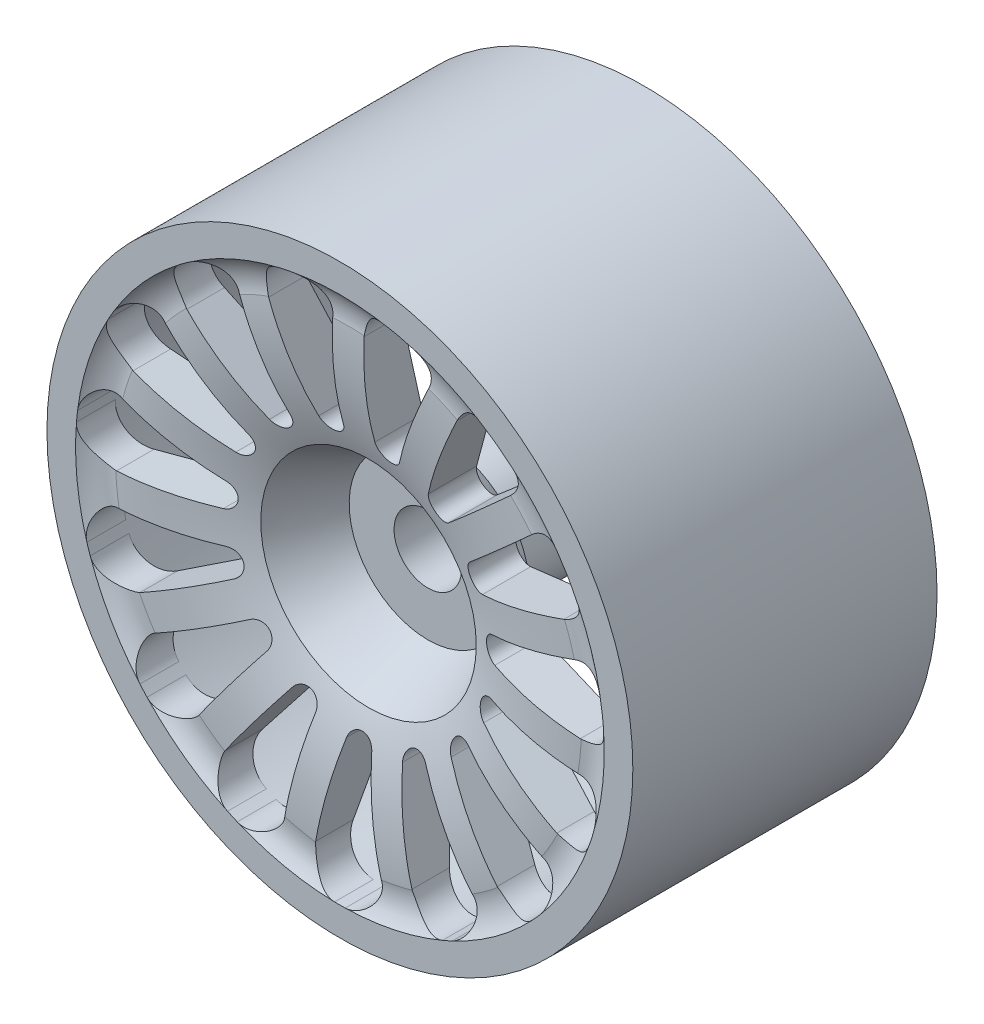
from build123d import *

# Parameters (mm, degrees)
CROQUIS1_R              = 26
CROQUIS1_R_2            = 23.46
SALIENTE_EXTRUIR1_DEPTH = 27
CROQUIS2_R              = 9.5631
SALIENTE_EXTRUIR2_DEPTH = 9.1948


with BuildPart() as part:
    # Croquis1 → Saliente-Extruir1 (new body)
    with BuildSketch(Plane.XY):
        Circle(CROQUIS1_R)
        Circle(CROQUIS1_R_2, mode=Mode.SUBTRACT)
    extrude(amount=-SALIENTE_EXTRUIR1_DEPTH)

    # Croquis2 → Saliente-Extruir2 (add)
    with BuildSketch(Plane.XY):
        with BuildLine():
            Line((1.397, 20.54620235), (1.397, 11.966276937))
            ThreePointArc((1.397, 11.966276937), (2.305137707, 10.844820264), (3.590900307, 11.499949031))
            Line((3.590900307, 11.499949031), (7.080670367, 19.338100919))
            ThreePointArc((7.080670367, 19.338100919), (7.034905865, 21.501525446), (5.338232059, 22.844580944))
            ThreePointArc((5.338232059, 22.844580944), (9.542041647, 21.431776436), (13.404857664, 19.25308783))
            ThreePointArc((13.404857664, 19.25308783), (11.271476548, 19.61528265), (9.633116376, 18.201678738))
            Line((9.633116376, 18.201678738), (6.143346316, 10.36352685))
            ThreePointArc((6.143346316, 10.36352685), (6.516833871, 8.969652318), (7.957901329, 9.045175464))
            Line((7.957901329, 9.045175464), (14.334028502, 14.786266158))
            ThreePointArc((14.334028502, 14.786266158), (15.172164579, 16.781266908), (14.168445815, 18.698308565))
            ThreePointArc((14.168445815, 18.698308565), (17.434177606, 15.697804025), (20.076883142, 12.136324126))
            ThreePointArc((20.076883142, 12.136324126), (18.27526042, 13.334929832), (16.203579417, 12.709919516))
            Line((16.203579417, 12.709919516), (9.827452243, 6.968828821))
            ThreePointArc((9.827452243, 6.968828821), (9.601710254, 5.54355), (10.948908915, 5.026408886))
            Line((10.948908915, 5.026408886), (19.108902889, 7.677751649))
            ThreePointArc((19.108902889, 7.677751649), (20.686018202, 9.159374868), (20.548806573, 11.318928767))
            ThreePointArc((20.548806573, 11.318928767), (22.311785872, 7.249538688), (23.277433133, 2.921079725))
            ThreePointArc((23.277433133, 2.921079725), (22.119085739, 4.748846502), (19.972296371, 5.020499743))
            Line((19.972296371, 5.020499743), (11.812302397, 2.36915698))
            ThreePointArc((11.812302397, 2.36915698), (11.026363706, 1.158917525), (12.046750683, 0.138530549))
            Line((12.046750683, 0.138530549), (20.579674367, -0.75831587))
            ThreePointArc((20.579674367, -0.75831587), (22.623071352, -0.046256297), (23.376091994, 1.982403356))
            ThreePointArc((23.376091994, 1.982403356), (23.331483665, -2.452237748), (22.453103465, -6.799245898))
            ThreePointArc((22.453103465, -6.799245898), (22.138320189, -4.658355531), (20.28762184, -3.537010045))
            Line((20.28762184, -3.537010045), (11.754698156, -2.640163627))
            ThreePointArc((11.754698156, -2.640163627), (10.544458702, -3.426102318), (11.061599816, -4.773300979))
            Line((11.061599816, -4.773300979), (18.492033186, -9.063263686))
            ThreePointArc((18.492033186, -9.063263686), (20.64838994, -9.243889327), (22.161438745, -7.696897605))
            ThreePointArc((22.161438745, -7.696897605), (20.316955973, -11.73), (17.746428229, -15.343920135))
            ThreePointArc((17.746428229, -15.343920135), (18.329637957, -13.260085572), (17.095033186, -11.482938664))
            Line((17.095033186, -11.482938664), (9.664599816, -7.192975957))
            ThreePointArc((9.664599816, -7.192975957), (8.239320995, -7.418717946), (8.163797849, -8.859785404))
            Line((8.163797849, -8.859785404), (13.206951473, -15.801090873))
            ThreePointArc((13.206951473, -15.801090873), (15.103414324, -16.843169915), (17.114871406, -16.045335046))
            ThreePointArc((17.114871406, -16.045335046), (13.789442019, -18.979538688), (9.971234331, -21.235491186))
            ThreePointArc((9.971234331, -21.235491186), (11.351594804, -19.569026354), (10.946557991, -17.443362868))
            Line((10.946557991, -17.443362868), (5.903404367, -10.502057399))
            ThreePointArc((5.903404367, -10.502057399), (4.509529835, -10.128569843), (3.854401069, -11.414332443))
            Line((3.854401069, -11.414332443), (5.638267869, -19.806765901))
            ThreePointArc((5.638267869, -19.806765901), (6.94692116, -21.530113409), (9.108987318, -21.61938829))
            ThreePointArc((9.108987318, -21.61938829), (4.877608267, -22.947342713), (0.471923431, -23.455252893))
            ThreePointArc((0.471923431, -23.455252893), (2.410757783, -22.4943047), (2.905323472, -20.387671165))
            Line((2.905323472, -20.387671165), (1.121456672, -11.995237707))
            ThreePointArc((1.121456672, -11.995237707), (0, -11.0871), (-1.121456672, -11.995237707))
            Line((-1.121456672, -11.995237707), (-2.905323472, -20.387671165))
            ThreePointArc((-2.905323472, -20.387671165), (-2.410757783, -22.4943047), (-0.471923431, -23.455252893))
            ThreePointArc((-0.471923431, -23.455252893), (-4.877608267, -22.947342713), (-9.108987318, -21.61938829))
            ThreePointArc((-9.108987318, -21.61938829), (-6.94692116, -21.530113409), (-5.638267869, -19.806765901))
            Line((-5.638267869, -19.806765901), (-3.854401069, -11.414332443))
            ThreePointArc((-3.854401069, -11.414332443), (-4.509529835, -10.128569843), (-5.903404367, -10.502057399))
            Line((-5.903404367, -10.502057399), (-10.946557991, -17.443362868))
            ThreePointArc((-10.946557991, -17.443362868), (-11.351594804, -19.569026354), (-9.971234331, -21.235491186))
            ThreePointArc((-9.971234331, -21.235491186), (-13.789442019, -18.979538688), (-17.114871406, -16.045335046))
            ThreePointArc((-17.114871406, -16.045335046), (-15.103414324, -16.843169915), (-13.206951473, -15.801090873))
            Line((-13.206951473, -15.801090873), (-8.163797849, -8.859785404))
            ThreePointArc((-8.163797849, -8.859785404), (-8.239320995, -7.418717946), (-9.664599816, -7.192975957))
            Line((-9.664599816, -7.192975957), (-17.095033186, -11.482938664))
            ThreePointArc((-17.095033186, -11.482938664), (-18.329637957, -13.260085572), (-17.746428229, -15.343920135))
            ThreePointArc((-17.746428229, -15.343920135), (-20.316955973, -11.73), (-22.161438745, -7.696897605))
            ThreePointArc((-22.161438745, -7.696897605), (-20.64838994, -9.243889327), (-18.492033186, -9.063263686))
            Line((-18.492033186, -9.063263686), (-11.061599816, -4.773300979))
            ThreePointArc((-11.061599816, -4.773300979), (-10.544458702, -3.426102318), (-11.754698156, -2.640163627))
            Line((-11.754698156, -2.640163627), (-20.28762184, -3.537010045))
            ThreePointArc((-20.28762184, -3.537010045), (-22.138320189, -4.658355531), (-22.453103465, -6.799245898))
            ThreePointArc((-22.453103465, -6.799245898), (-23.331483665, -2.452237748), (-23.376091994, 1.982403356))
            ThreePointArc((-23.376091994, 1.982403356), (-22.623071352, -0.046256297), (-20.579674367, -0.75831587))
            Line((-20.579674367, -0.75831587), (-12.046750683, 0.138530549))
            ThreePointArc((-12.046750683, 0.138530549), (-11.026363706, 1.158917525), (-11.812302397, 2.36915698))
            Line((-11.812302397, 2.36915698), (-19.972296371, 5.020499743))
            ThreePointArc((-19.972296371, 5.020499743), (-22.119085739, 4.748846502), (-23.277433133, 2.921079725))
            ThreePointArc((-23.277433133, 2.921079725), (-22.311785872, 7.249538688), (-20.548806573, 11.318928767))
            ThreePointArc((-20.548806573, 11.318928767), (-20.686018202, 9.159374868), (-19.108902889, 7.677751649))
            Line((-19.108902889, 7.677751649), (-10.948908915, 5.026408886))
            ThreePointArc((-10.948908915, 5.026408886), (-9.601710254, 5.54355), (-9.827452243, 6.968828821))
            Line((-9.827452243, 6.968828821), (-16.203579417, 12.709919516))
            ThreePointArc((-16.203579417, 12.709919516), (-18.27526042, 13.334929832), (-20.076883142, 12.136324126))
            ThreePointArc((-20.076883142, 12.136324126), (-17.434177606, 15.697804025), (-14.168445815, 18.698308565))
            ThreePointArc((-14.168445815, 18.698308565), (-15.172164579, 16.781266908), (-14.334028502, 14.786266158))
            Line((-14.334028502, 14.786266158), (-7.957901329, 9.045175464))
            ThreePointArc((-7.957901329, 9.045175464), (-6.516833871, 8.969652318), (-6.143346316, 10.36352685))
            Line((-6.143346316, 10.36352685), (-9.633116376, 18.201678738))
            ThreePointArc((-9.633116376, 18.201678738), (-11.271476548, 19.61528265), (-13.404857664, 19.25308783))
            ThreePointArc((-13.404857664, 19.25308783), (-9.542041647, 21.431776436), (-5.338232059, 22.844580944))
            ThreePointArc((-5.338232059, 22.844580944), (-7.034905865, 21.501525446), (-7.080670367, 19.338100919))
            Line((-7.080670367, 19.338100919), (-3.590900307, 11.499949031))
            ThreePointArc((-3.590900307, 11.499949031), (-2.305137707, 10.844820264), (-1.397, 11.966276937))
            Line((-1.397, 11.966276937), (-1.397, 20.54620235))
            ThreePointArc((-1.397, 20.54620235), (-2.318751983, 22.503974899), (-4.415010516, 23.04081774))
            ThreePointArc((-4.415010516, 23.04081774), (0, 23.46), (4.415010516, 23.04081774))
            ThreePointArc((4.415010516, 23.04081774), (2.318751983, 22.503974899), (1.397, 20.54620235))
        make_face()
        Circle(CROQUIS2_R, mode=Mode.SUBTRACT)
    extrude(amount=-SALIENTE_EXTRUIR2_DEPTH)

    # Croquis3 → Cortar-Revolución1 (revolve, cut)
    with BuildSketch(Plane(origin=(0, 0, 0), x_dir=(1, 0, 0), z_dir=(0, 1, 0)), mode=Mode.PRIVATE) as cortar_revoluci_n1_sk:
        Polygon((-9.5631, 6.5405), (-9.5631, 30.1625), (-23.46, 30.1625), (-23.46, 3.4544), align=None)
        with BuildLine():
            Line((-9.5631, 0), (-9.5631, 2.54))
            ThreePointArc((-9.5631, 2.54), (-15.018806531, 1.053120268), (-20.666, 0.762))
            ThreePointArc((-20.666, 0.762), (-22.152542948, 0.709324142), (-23.46, 0))
            Line((-23.46, 0), (-9.5631, 0))
        make_face()
    revolve(cortar_revoluci_n1_sk.sketch.rotate(Axis((0, 0, 0), (0, 0, -1)), 180), axis=Axis((0, 0, 0), (0, 0, -1)), mode=Mode.SUBTRACT)

    # Croquis4 → Revolución1 (revolve)
    with BuildSketch(Plane(origin=(0, 0, 0), x_dir=(0, 0, -1), z_dir=(1, 0, 0)), mode=Mode.PRIVATE) as revoluci_n1_sk:
        Polygon((30.1625, 4.445), (23.8125, 4.445), (23.8125, 5.842), (9.0805, 5.842), (9.0805, 6.985), (9.0805, 7.77756929), (5.430277119, 9.5631), (2.54, 9.5631), (7.8105, 6.985), (7.8105, 2.999994), (9.0805, 2.999994), (23.8125, 2.999994), (30.1625, 2.999994), align=None)
    revolve(revoluci_n1_sk.sketch.rotate(Axis((0, 0, 0), (0, 0, -1)), 90), axis=Axis((0, 0, 0), (0, 0, -1)))


solid = part.part
